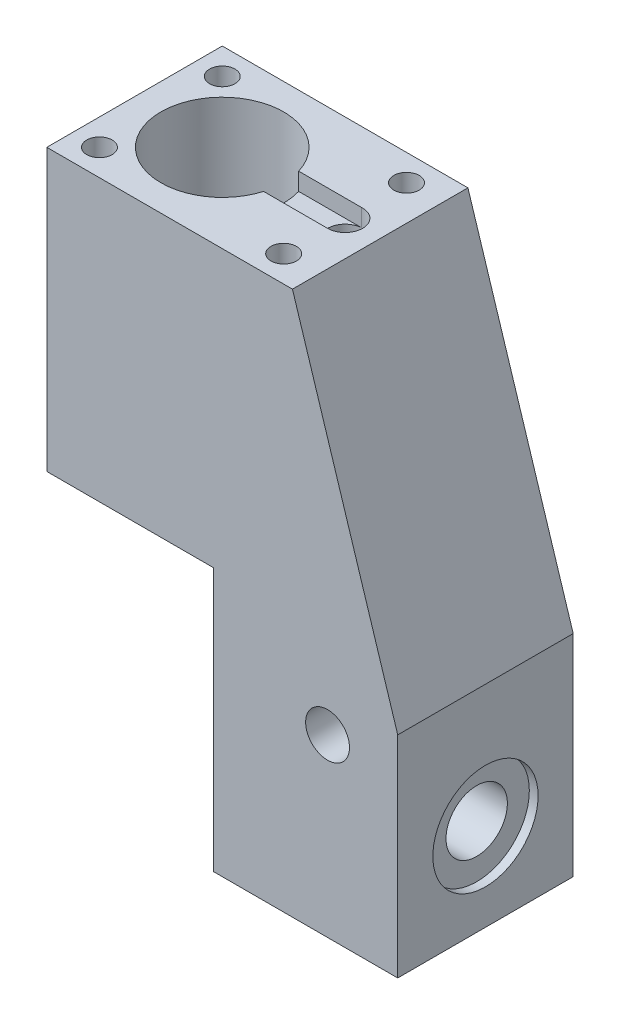
from build123d import *

# Parameters (mm, degrees)
BOSS_EXTRUDE1_DEPTH                                  = 10
CUT_EXTRUDE1_REACH                                   = 76.458
SKETCH2_R                                            = 7
CSK_FOR_M8_FLAT_HEAD_MACHINE_SCREW1_D                = 7
CSK_FOR_M8_FLAT_HEAD_MACHINE_SCREW1_CSINK_D          = 8
CSK_FOR_M8_FLAT_HEAD_MACHINE_SCREW1_CSINK_ANGLE      = 90
M4X0_7_TAPPED_HOLE1_REACH                            = 76.458
M4X0_7_TAPPED_HOLE1_BORE_R                           = 2
CUT_EXTRUDE2_REACH                                   = 78.446
SKETCH8_R                                            = 2.5
CUT_EXTRUDE3_REACH                                   = 76.458
CUT_EXTRUDE3_END_RADIUS                              = 2.5
SKETCH9_R                                            = 1.25
TAP_DRILL_FOR_M3_5X0_6_TAP1_D                        = 2.9
TAP_DRILL_FOR_M3_5X0_6_TAP1_DEPTH                    = 9
TAP_DRILL_FOR_M3_5X0_6_TAP1_TIP                      = 0.871247898
CUT_EXTRUDE4_REACH                                   = 76.458
CUT_EXTRUDE4_END_RADIUS                              = 7
SKETCH14_R                                           = 1.6
CBORE_FOR_M4_CROSS_RECESS_PAN_HEAD_SCREW_D           = 2.5
CBORE_FOR_M4_CROSS_RECESS_PAN_HEAD_SCREW_CBORE_D     = 4
CBORE_FOR_M4_CROSS_RECESS_PAN_HEAD_SCREW_CBORE_DEPTH = 30
CUT_EXTRUDE5_DEPTH                                   = 2
SKETCH18_R                                           = 6
CUT_EXTRUDE6_DEPTH                                   = 1
CHAMFER1_SIZE                                        = 0.5


with BuildPart() as part:
    # Sketch1 → Boss-Extrude1 (new, symmetric)
    with BuildSketch(Plane.XY):
        Polygon((0, 0), (0, 24), (-12, 62), (-40, 62), (-40, 30), (-21, 30), (-21, 0), align=None)
    extrude(amount=BOSS_EXTRUDE1_DEPTH, both=True)

    # Sketch2 → Cut-Extrude1 (cut, up to next)
    with BuildSketch(Plane(origin=(0, 62, 0), x_dir=(1, 0, 0), z_dir=(0, 1, 0)), mode=Mode.PRIVATE) as cut_extrude1_sk1:
        with Locations(Location((-30, 0, 0), (0, 0, 270))):
            Circle(SKETCH2_R)
    cut_extrude1_tool1 = extrude(cut_extrude1_sk1.sketch, amount=-CUT_EXTRUDE1_REACH, mode=Mode.PRIVATE) & part.part
    add(cut_extrude1_tool1.solids().sort_by_distance((-30, 62, 0))[0], mode=Mode.SUBTRACT)

    # CSK for M8 Flat Head Machine Screw1 (through all)
    with Locations(Plane(origin=(0, 0, 0), x_dir=(0, 0, -1), z_dir=(1, 0, 0))):
        with Locations((0, 10)):
            CounterSinkHole(CSK_FOR_M8_FLAT_HEAD_MACHINE_SCREW1_D / 2, CSK_FOR_M8_FLAT_HEAD_MACHINE_SCREW1_CSINK_D / 2, counter_sink_angle=CSK_FOR_M8_FLAT_HEAD_MACHINE_SCREW1_CSINK_ANGLE)

    # M4x0.7 Tapped Hole1 bore → M4x0.7 Tapped Hole1 (cut, up to next)
    with BuildSketch(Plane(origin=(0, 0, 0), x_dir=(-1, 0, 0), z_dir=(0, -1, 0)), mode=Mode.PRIVATE) as m4x0_7_tapped_hole1_sk1:
        with Locations((8, 0)):
            Circle(M4X0_7_TAPPED_HOLE1_BORE_R)
    m4x0_7_tapped_hole1_tool1 = extrude(m4x0_7_tapped_hole1_sk1.sketch, amount=-M4X0_7_TAPPED_HOLE1_REACH, mode=Mode.PRIVATE) & part.part
    # M4x0.7 Tapped Hole1 bore → M4x0.7 Tapped Hole1 (cut, up to next)
    with BuildSketch(Plane(origin=(0, 0, 0), x_dir=(-1, 0, 0), z_dir=(0, -1, 0)), mode=Mode.PRIVATE) as m4x0_7_tapped_hole1_sk2:
        with Locations((16, 0)):
            Circle(M4X0_7_TAPPED_HOLE1_BORE_R)
    m4x0_7_tapped_hole1_tool2 = extrude(m4x0_7_tapped_hole1_sk2.sketch, amount=-M4X0_7_TAPPED_HOLE1_REACH, mode=Mode.PRIVATE) & part.part
    add(m4x0_7_tapped_hole1_tool1.solids().sort_by_distance((-8, 0, 0))[0], mode=Mode.SUBTRACT)
    add(m4x0_7_tapped_hole1_tool2.solids().sort_by_distance((-16, 0, 0))[0], mode=Mode.SUBTRACT)

    # Sketch8 → Cut-Extrude2 (cut, up to next)
    with BuildSketch(Plane.XY.offset(10), mode=Mode.PRIVATE) as cut_extrude2_sk1:
        with Locations((-8, 20)):
            Circle(SKETCH8_R)
    cut_extrude2_tool1 = extrude(cut_extrude2_sk1.sketch, amount=-CUT_EXTRUDE2_REACH, mode=Mode.PRIVATE) & part.part
    add(cut_extrude2_tool1.solids().sort_by_distance((-8, 20, 10))[0], mode=Mode.SUBTRACT)

    # Cut-Extrude3: up to this cylinder (the profile starts outside it)
    cut_extrude3_end = Plane(origin=(-8, 20, 0), z_dir=(0, 0, 1)) * Cylinder(CUT_EXTRUDE3_END_RADIUS, 158.916, mode=Mode.PRIVATE)
    # Sketch9 → Cut-Extrude3 (cut, up to the surface)
    with BuildSketch(Plane.XZ, mode=Mode.PRIVATE) as cut_extrude3_sk1:
        with Locations(Location((-8, 0, 0), (0, 0, 270))):
            Circle(SKETCH9_R)
    cut_extrude3_tool1 = extrude(cut_extrude3_sk1.sketch, amount=-CUT_EXTRUDE3_REACH, mode=Mode.PRIVATE) - cut_extrude3_end
    add(cut_extrude3_tool1.solids().sort_by_distance((-8, 0, 0))[0], mode=Mode.SUBTRACT)

    # Tap Drill for M3.5x0.6 Tap1
    with Locations(Plane(origin=(0, 62, 0), x_dir=(1, 0, 0), z_dir=(0, 1, 0))):
        with Locations((-37, 7), (-16, 7), (-16, -7), (-37, -7)):
            Hole(TAP_DRILL_FOR_M3_5X0_6_TAP1_D / 2, depth=TAP_DRILL_FOR_M3_5X0_6_TAP1_DEPTH)
            with Locations((0, 0, -(TAP_DRILL_FOR_M3_5X0_6_TAP1_DEPTH + TAP_DRILL_FOR_M3_5X0_6_TAP1_TIP / 2))):  # 118° drill point
                Cone(0, TAP_DRILL_FOR_M3_5X0_6_TAP1_D / 2, TAP_DRILL_FOR_M3_5X0_6_TAP1_TIP, mode=Mode.SUBTRACT)

    # Cut-Extrude4: up to this cylinder (the profile starts outside it)
    cut_extrude4_end = Plane(origin=(-30, 45, 0), z_dir=(0, 1, 0)) * Cylinder(CUT_EXTRUDE4_END_RADIUS, 167.916, mode=Mode.PRIVATE)
    # Sketch14 → Cut-Extrude4 (cut, up to the surface)
    with BuildSketch(Plane.ZY.offset(40), mode=Mode.PRIVATE) as cut_extrude4_sk1:
        with Locations(Location((-3, 45, 0), (0, 0, 270))):
            Circle(SKETCH14_R)
    cut_extrude4_tool1 = extrude(cut_extrude4_sk1.sketch, amount=-CUT_EXTRUDE4_REACH, mode=Mode.PRIVATE) - cut_extrude4_end
    add(cut_extrude4_tool1.solids().sort_by_distance((-40, 45, -3))[0], mode=Mode.SUBTRACT)
    # Sketch14 → Cut-Extrude4 (cut, up to the surface)
    with BuildSketch(Plane.ZY.offset(40), mode=Mode.PRIVATE) as cut_extrude4_sk2:
        with Locations(Location((3, 45, 0), (0, 0, 270))):
            Circle(SKETCH14_R)
    cut_extrude4_tool2 = extrude(cut_extrude4_sk2.sketch, amount=-CUT_EXTRUDE4_REACH, mode=Mode.PRIVATE) - cut_extrude4_end
    add(cut_extrude4_tool2.solids().sort_by_distance((-40, 45, 3))[0], mode=Mode.SUBTRACT)

    # CBORE for M4 Cross Recess Pan Head Screw1 (through all)
    with Locations(Plane(origin=(0, 62, 0), x_dir=(1, 0, 0), z_dir=(0, 1, 0))):
        with Locations((-16, 0)):
            CounterBoreHole(CBORE_FOR_M4_CROSS_RECESS_PAN_HEAD_SCREW_D / 2, CBORE_FOR_M4_CROSS_RECESS_PAN_HEAD_SCREW_CBORE_D / 2, CBORE_FOR_M4_CROSS_RECESS_PAN_HEAD_SCREW_CBORE_DEPTH)

    # Sketch17 → Cut-Extrude5 (cut)
    with BuildSketch(Plane(origin=(0, 62, 0), x_dir=(1, 0, 0), z_dir=(0, 1, 0))):
        with BuildLine():
            Line((-16.110062598, 1.99696926), (-16.110062598, 2))
            Line((-16.110062598, 2), (-23.291796068, 2))
            ThreePointArc((-23.291796068, 2), (-23.073333142, 1.010587075), (-23, 0))
            ThreePointArc((-23, 0), (-23.073333142, -1.010587075), (-23.291796068, -2))
            Line((-23.291796068, -2), (-16.110062598, -2))
            Line((-16.110062598, -2), (-16.110062598, -1.99696926))
            ThreePointArc((-16.110062598, -1.99696926), (-18, 0), (-16.110062598, 1.99696926))
        make_face()
    extrude(amount=-CUT_EXTRUDE5_DEPTH, mode=Mode.SUBTRACT)

    # Sketch18 → Cut-Extrude6 (cut)
    with BuildSketch(Plane(origin=(0, 0, 0), x_dir=(0, 0, -1), z_dir=(1, 0, 0))):
        with Locations((0, 10)):
            Circle(SKETCH18_R)
    extrude(amount=-CUT_EXTRUDE6_DEPTH, mode=Mode.SUBTRACT)

    # Chamfer1
    chamfer1_edges = [part.edges().sort_by_distance(p)[0] for p in [
        (-21, 10, -3.5),
    ]]
    chamfer(chamfer1_edges, length=CHAMFER1_SIZE)


solid = part.part
